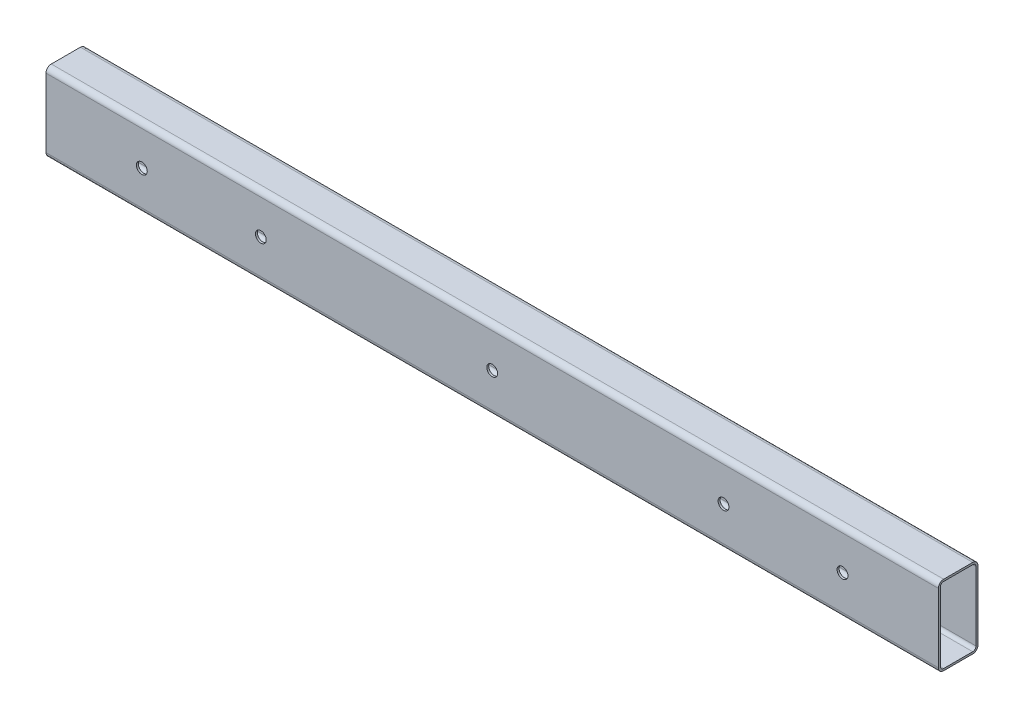
from build123d import *

# Parameters (mm, degrees)
EXTRUDE_THIN1_DEPTH      = 675
EXTRUDE_THIN1_DEPTH_BACK = 675
SKETCH4_R                = 8.2
CUT_EXTRUDE3_DEPTH       = 110
SKETCH5_R                = 8.2
CUT_EXTRUDE4_DEPTH       = 110


with BuildPart() as part:
    # Sketch1 → Extrude-Thin1 (new, two sides: drawn at the far end of the back side and taken through both)
    with BuildSketch(Plane(origin=(0, 0, 0), x_dir=(0, 0, -1), z_dir=(1, 0, 0)).offset(-EXTRUDE_THIN1_DEPTH_BACK)):
        with BuildLine():
            Line((-30, 52), (-30, -52))
            ThreePointArc((-30, -52), (-27.656854249, -57.656854249), (-22, -60))
            Line((-22, -60), (22, -60))
            ThreePointArc((22, -60), (27.656854249, -57.656854249), (30, -52))
            Line((30, -52), (30, 52))
            ThreePointArc((30, 52), (27.656854249, 57.656854249), (22, 60))
            Line((22, 60), (-22, 60))
            ThreePointArc((-22, 60), (-27.656854249, 57.656854249), (-30, 52))
        make_face()
        with BuildLine():
            Line((-27, 52), (-27, -52))
            ThreePointArc((-27, -52), (-25.535533906, -55.535533906), (-22, -57))
            Line((-22, -57), (22, -57))
            ThreePointArc((22, -57), (25.535533906, -55.535533906), (27, -52))
            Line((27, -52), (27, 52))
            ThreePointArc((27, 52), (25.535533906, 55.535533906), (22, 57))
            Line((22, 57), (-22, 57))
            ThreePointArc((-22, 57), (-25.535533906, 55.535533906), (-27, 52))
        make_face(mode=Mode.SUBTRACT)
    extrude(amount=EXTRUDE_THIN1_DEPTH + EXTRUDE_THIN1_DEPTH_BACK)

    # Sketch4 → Cut-Extrude3 (cut)
    with BuildSketch(Plane.XY.offset(30)):
        with Locations(Location((0, 0, 0), (0, 0, 180))):
            Circle(SKETCH4_R)
    extrude(amount=-CUT_EXTRUDE3_DEPTH, mode=Mode.SUBTRACT)

    # Sketch5 → Cut-Extrude4 (cut)
    with BuildSketch(Plane(origin=(0, -1598, -30), x_dir=(1, 0, 0), z_dir=(0, 0, 1))):
        with Locations(Location((350, 1598, 0), (0, 0, 180))):
            Circle(SKETCH5_R)
        with Locations(Location((530, 1598, 0), (0, 0, 180))):
            Circle(SKETCH5_R)
        with Locations(Location((-350, 1598, 0), (0, 0, 180))):
            Circle(SKETCH5_R)
        with Locations(Location((-530, 1598, 0), (0, 0, 180))):
            Circle(SKETCH5_R)
    extrude(amount=CUT_EXTRUDE4_DEPTH, mode=Mode.SUBTRACT)


solid = part.part
